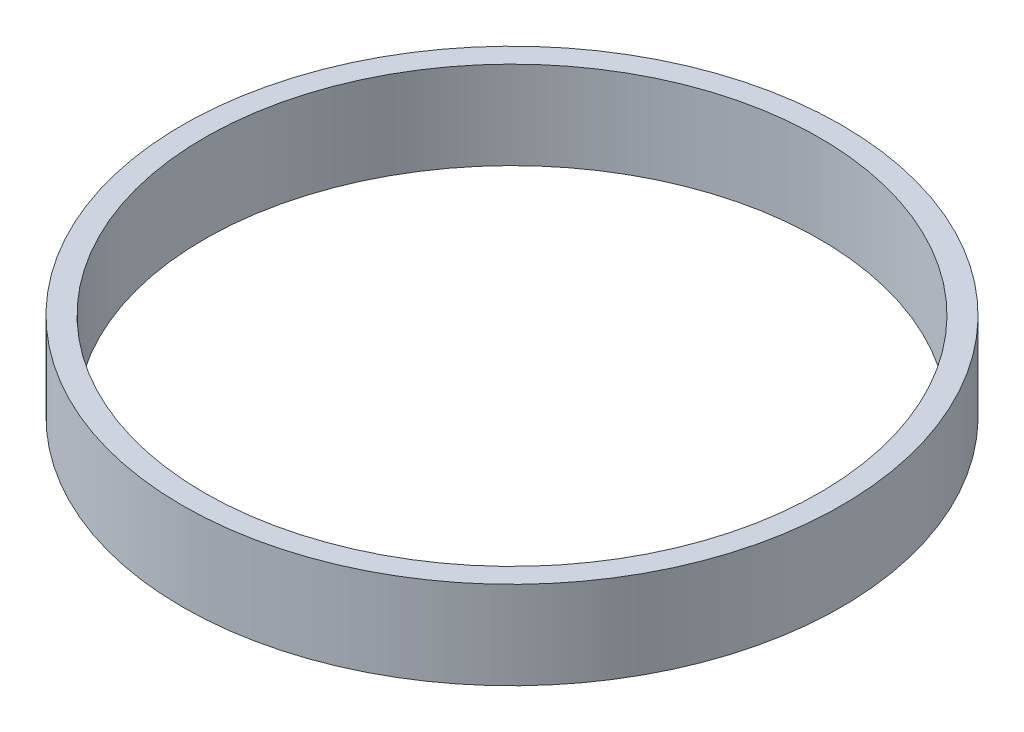
from build123d import *

# Parameters (mm, degrees)
SKETCH1_R           = 37.5
SKETCH1_R_2         = 35
BOSS_EXTRUDE1_DEPTH = 10


with BuildPart() as part:
    # Sketch1 → Boss-Extrude1 (new body)
    with BuildSketch(Plane(origin=(0, 0, 0), x_dir=(1, 0, 0), z_dir=(0, 1, 0))):
        with Locations(Location((0, 0, 0), (0, 0, 270))):
            Circle(SKETCH1_R)
        with Locations(Location((0, 0, 0), (0, 0, 270))):
            Circle(SKETCH1_R_2, mode=Mode.SUBTRACT)
    extrude(amount=BOSS_EXTRUDE1_DEPTH)


solid = part.part
